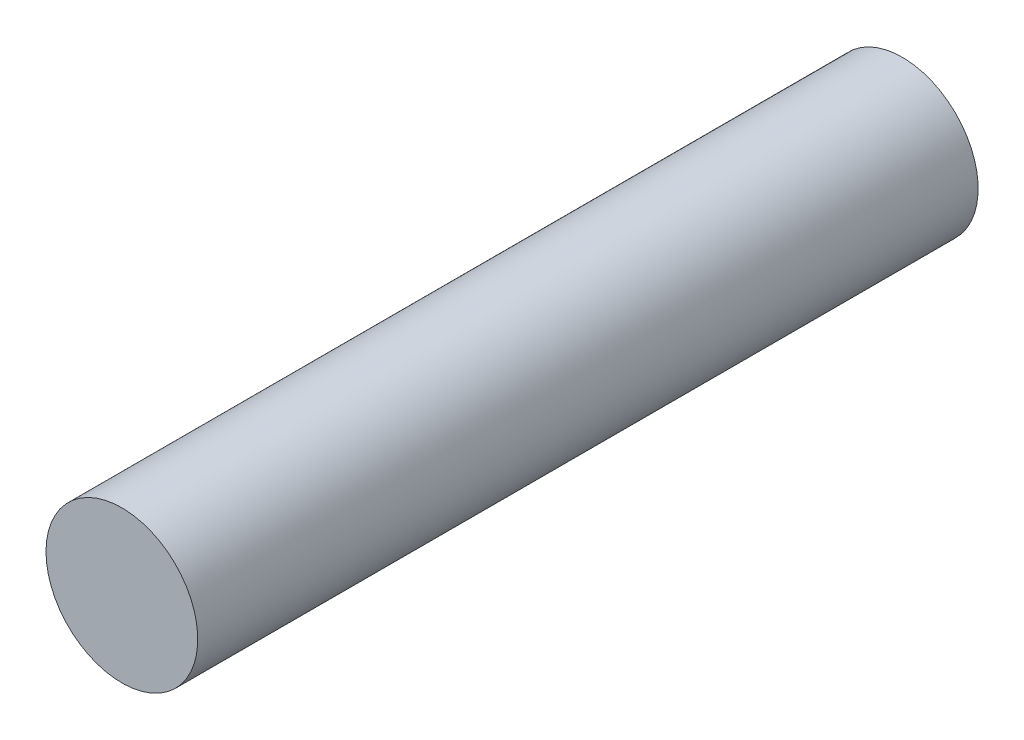
from build123d import *

# Parameters (mm, degrees)
SKETCH1_R           = 17.5
BOSS_EXTRUDE1_DEPTH = 180


with BuildPart() as part:
    # Sketch1 → Boss-Extrude1 (new body)
    with BuildSketch(Plane.XY):
        with Locations(Location((0, 0, 0), (0, 0, 180))):
            Circle(SKETCH1_R)
    extrude(amount=BOSS_EXTRUDE1_DEPTH)


solid = part.part
